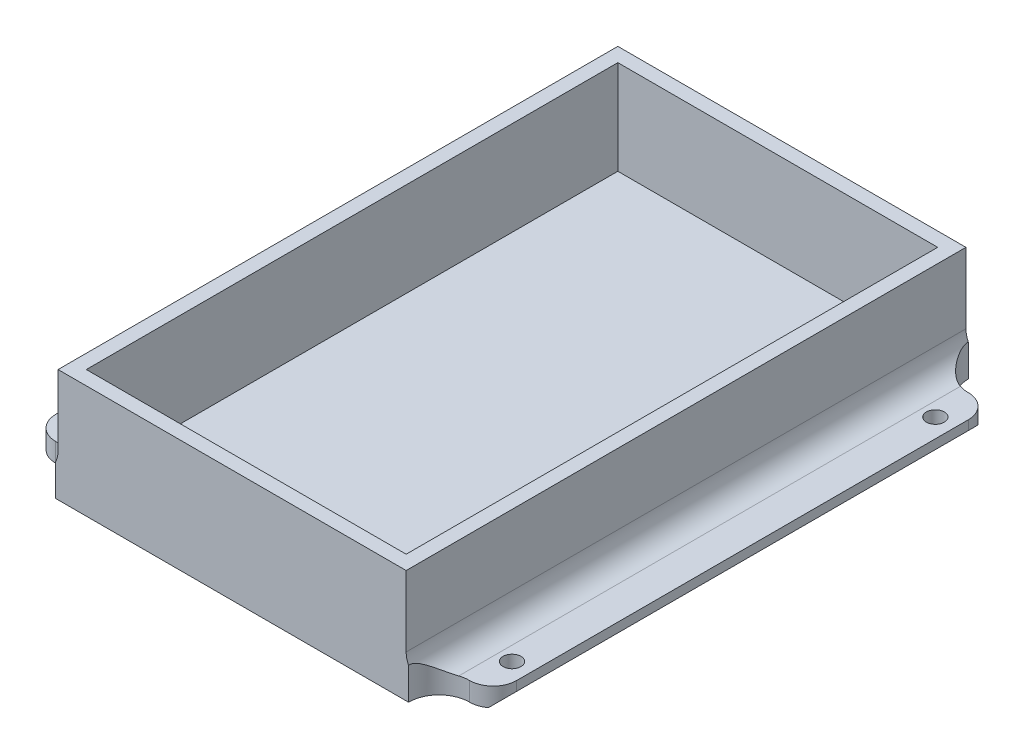
from build123d import *

# Parameters (mm, degrees)
SKETCH_1_W               = 98
SKETCH_1_H               = 119
SKETCH_1_R               = 1.9
EXTRUDE_1_DEPTH          = 4
SKETCH_2_W               = 74
SKETCH_2_H               = 119
SKETCH_2_W_2             = 68
SKETCH_2_H_2             = 113
EXTRUDE_1_2_DEPTH        = 20
FILLET_1_R               = 5
CHAMFER_1_SIZE           = 2
CUT_EXTRUDE_1_DEPTH      = 80.631965943
CUT_EXTRUDE_1_DEPTH_BACK = 80.631965943
SKETCH_3_R               = 6.5
FILLET_2_R               = 5


with BuildPart() as part:
    # Эскиз1 → Extrude 1 (new body)
    with BuildSketch(Plane(origin=(0, 0, 0), x_dir=(1, 0, 0), z_dir=(0, 1, 0))):
        Rectangle(SKETCH_1_W, SKETCH_1_H)
        with Locations(Location((-45, 45, 0), (0, 0, 270))):
            Circle(SKETCH_1_R, mode=Mode.SUBTRACT)
        with Locations(Location((45, 45, 0), (0, 0, 90))):
            Circle(SKETCH_1_R, mode=Mode.SUBTRACT)
        with Locations(Location((45, -45, 0), (0, 0, 270))):
            Circle(SKETCH_1_R, mode=Mode.SUBTRACT)
        with Locations(Location((-45, -45, 0), (0, 0, 90))):
            Circle(SKETCH_1_R, mode=Mode.SUBTRACT)
    extrude(amount=EXTRUDE_1_DEPTH)

    # Эскиз2 → Extrude 1 2 (add)
    with BuildSketch(Plane(origin=(0, 4, 0), x_dir=(1, 0, 0), z_dir=(0, 1, 0))):
        Rectangle(SKETCH_2_W, SKETCH_2_H)
        Rectangle(SKETCH_2_W_2, SKETCH_2_H_2, mode=Mode.SUBTRACT)
    extrude(amount=EXTRUDE_1_2_DEPTH)

    # Скругление1
    fillet_1_edges = [part.edges().sort_by_distance(p)[0] for p in [
        (37, 4, 0),
        (-37, 4, 0),
    ]]
    fillet(fillet_1_edges, radius=FILLET_1_R)

    # Фаска1
    chamfer_1_edges = [part.edges().sort_by_distance(p)[0] for p in [
        (-49, 0, 0),
        (49, 0, 0),
    ]]
    chamfer(chamfer_1_edges, length=CHAMFER_1_SIZE)

    # Эскиз3 → Вырез-Вытянуть1 (cut, two sides: drawn at the far end of the back side and taken through both)
    with BuildSketch(Plane(origin=(0, 4, 0), x_dir=(1, 0, 0), z_dir=(0, 1, 0)).offset(-CUT_EXTRUDE_1_DEPTH_BACK)):
        with Locations((44, 59.5)):
            Circle(SKETCH_3_R)
        with Locations((-44, 59.5)):
            Circle(SKETCH_3_R)
        with Locations((44, -59.5)):
            Circle(SKETCH_3_R)
        with Locations((-44, -59.5)):
            Circle(SKETCH_3_R)
    extrude(amount=CUT_EXTRUDE_1_DEPTH + CUT_EXTRUDE_1_DEPTH_BACK, mode=Mode.SUBTRACT)

    # Скругление2
    fillet_2_edges = [part.edges().sort_by_distance(p)[0] for p in [
        (-49, 3, 55.346688069),
        (49, 3, 55.346688069),
        (-49, 3, -55.346688069),
        (49, 3, -55.346688069),
    ]]
    fillet(fillet_2_edges, radius=FILLET_2_R)


solid = part.part
